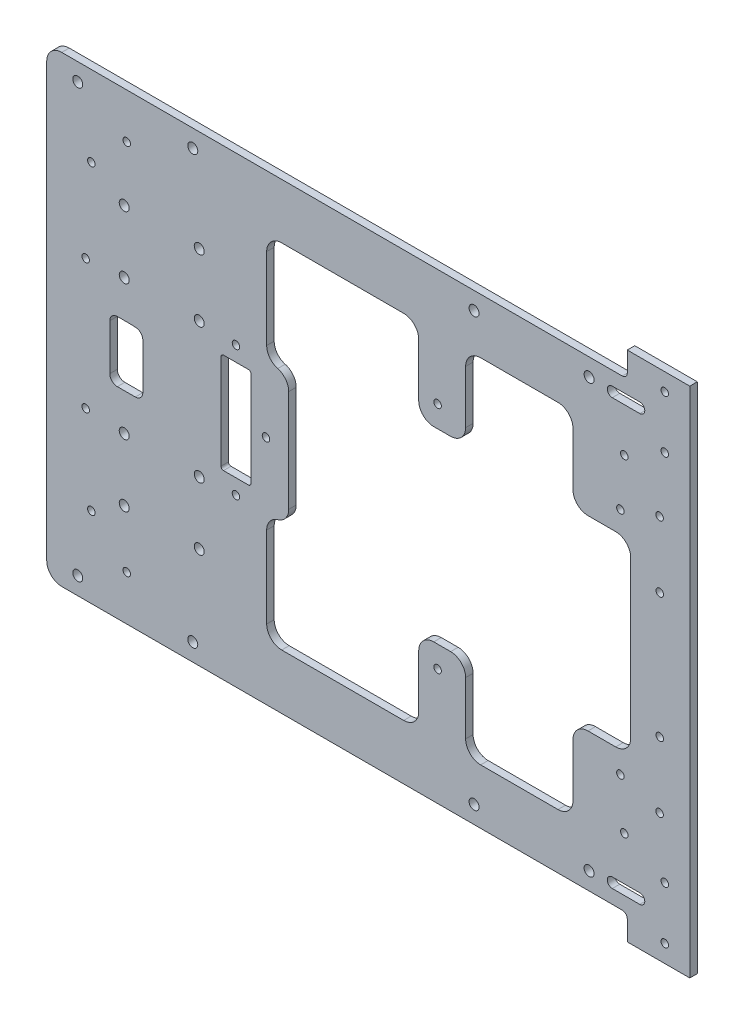
from build123d import *

# Parameters (mm, degrees)
EXTRUDE_1_DEPTH      = 3
FILLET_1_R           = 6
FILLET_2_R           = 6
FILLET_3_R           = 2
FILLET_4_R           = 2
SKETCH_3_R           = 2
CUT_EXTRUDE_1_DEPTH  = 3
SKETCH_4_R           = 1.5
CUT_EXTRUDE_2_DEPTH  = 10
SKETCH_5_R           = 2
CUT_EXTRUDE_3_DEPTH  = 10
CUT_EXTRUDE_5_REACH  = 278.87
SKETCH_9_R           = 1.5
CUT_EXTRUDE_6_REACH  = 278.87
FILLET_6_R           = 6
FILLET_7_R           = 6
FILLET_8_R           = 6
CUT_EXTRUDE_8_REACH  = 278.87
SKETCH_7_R           = 1.5
SKETCH_7_R_2         = 1.499999999
CUT_EXTRUDE_9_REACH  = 278.87
CUT_EXTRUDE_10_REACH = 278.87
SKETCH_13_R          = 1.5


with BuildPart() as part:
    # 草图2 → 凸台-拉伸1 (new body)
    with BuildSketch(Plane.XY):
        Polygon((0, -92.5), (0, 92.5), (232.18, 92.5), (232.18, 102.5), (257.18, 102.5), (257.18, -102.5), (232.18, -102.5), (232.18, -92.5), align=None)
    extrude(amount=EXTRUDE_1_DEPTH)

    # 圆角1
    fillet_1_edges = [part.edges().sort_by_distance(p)[0] for p in [
        (0, -92.5, 1.5),
    ]]
    fillet(fillet_1_edges, radius=FILLET_1_R)

    # 圆角2
    fillet_2_edges = [part.edges().sort_by_distance(p)[0] for p in [
        (0, 92.5, 1.5),
    ]]
    fillet(fillet_2_edges, radius=FILLET_2_R)

    # 圆角3
    fillet_3_edges = [part.edges().sort_by_distance(p)[0] for p in [
        (232.18, -92.5, 1.5),
    ]]
    fillet(fillet_3_edges, radius=FILLET_3_R)

    # 圆角4
    fillet_4_edges = [part.edges().sort_by_distance(p)[0] for p in [
        (232.18, 92.5, 1.5),
    ]]
    fillet(fillet_4_edges, radius=FILLET_4_R)

    # 草图3 → 切除-拉伸1 (cut)
    with BuildSketch(Plane(origin=(0, 0, 0), x_dir=(-1, 0, 0), z_dir=(0, 0, -1))):
        with Locations((-216.91, 85.5)):
            Circle(SKETCH_3_R)
        with Locations((-170.91, 85.5)):
            Circle(SKETCH_3_R)
        with Locations(Location((-170.91, -85.5, 0), (0, 0, 180))):
            Circle(SKETCH_3_R)
        with Locations(Location((-216.91, -85.5, 0), (0, 0, 180))):
            Circle(SKETCH_3_R)
        with Locations((-12.41, 85.5)):
            Circle(SKETCH_3_R)
        with Locations((-58.41, 85.5)):
            Circle(SKETCH_3_R)
        with Locations(Location((-58.41, -85.5, 0), (0, 0, 180))):
            Circle(SKETCH_3_R)
        with Locations(Location((-12.41, -85.5, 0), (0, 0, 180))):
            Circle(SKETCH_3_R)
    extrude(amount=-CUT_EXTRUDE_1_DEPTH, mode=Mode.SUBTRACT)

    # 草图4 → 切除-拉伸2 (cut)
    with BuildSketch(Plane(origin=(0, 0, 0), x_dir=(-1, 0, 0), z_dir=(0, 0, -1))):
        with Locations((-247.18, -74.5)):
            Circle(SKETCH_4_R)
        with Locations((-247.18, -95.5)):
            Circle(SKETCH_4_R)
        with Locations((-247.18, 95.5)):
            Circle(SKETCH_4_R)
        with Locations((-247.18, 74.5)):
            Circle(SKETCH_4_R)
        with Locations((-245.123007941, -51.335941194)):
            Circle(SKETCH_4_R)
        with Locations((-230.980872317, -65.478076818)):
            Circle(SKETCH_4_R)
        with Locations((-230.980872317, 65.478076818)):
            Circle(SKETCH_4_R)
        with Locations((-245.123007941, 51.335941194)):
            Circle(SKETCH_4_R)
        with Locations((-17.857864376, -60.357864376)):
            Circle(SKETCH_4_R)
        with Locations((-32, -74.5)):
            Circle(SKETCH_4_R)
        with Locations((-32, 74.5)):
            Circle(SKETCH_4_R)
        with Locations((-17.857864376, 60.357864376)):
            Circle(SKETCH_4_R)
        with BuildLine():
            Line((-237.18, -83), (-226.18, -83))
            ThreePointArc((-226.18, -83), (-224.18, -85), (-226.18, -87))
            Line((-226.18, -87), (-237.18, -87))
            ThreePointArc((-237.18, -87), (-239.18, -85), (-237.18, -83))
        make_face()
        with BuildLine():
            Line((-237.18, 83), (-226.18, 83))
            ThreePointArc((-226.18, 83), (-224.18, 85), (-226.18, 87))
            Line((-226.18, 87), (-237.18, 87))
            ThreePointArc((-237.18, 87), (-239.18, 85), (-237.18, 83))
        make_face()
    extrude(amount=-CUT_EXTRUDE_2_DEPTH, mode=Mode.SUBTRACT)

    # 草图5 → 切除-拉伸3 (cut)
    with BuildSketch(Plane(origin=(0, 0, 0), x_dir=(-1, 0, 0), z_dir=(0, 0, -1))):
        with Locations((-61, -52)):
            Circle(SKETCH_5_R)
        with Locations((-61, -27)):
            Circle(SKETCH_5_R)
        with Locations((-31, -27)):
            Circle(SKETCH_5_R)
        with Locations((-31, -52)):
            Circle(SKETCH_5_R)
        with Locations((-31, 52)):
            Circle(SKETCH_5_R)
        with Locations((-31, 27)):
            Circle(SKETCH_5_R)
        with Locations((-61, 27)):
            Circle(SKETCH_5_R)
        with Locations((-61, 52)):
            Circle(SKETCH_5_R)
    extrude(amount=-CUT_EXTRUDE_3_DEPTH, mode=Mode.SUBTRACT)

    # 草图9 → 切除-拉伸5 (cut, up to next)
    with BuildSketch(Plane(origin=(0, 0, 0), x_dir=(-1, 0, 0), z_dir=(0, 0, -1)), mode=Mode.PRIVATE) as cut_extrude_5_sk1:
        with Locations((-229.424334412, -45.9)):
            Circle(SKETCH_9_R)
    cut_extrude_5_tool1 = extrude(cut_extrude_5_sk1.sketch, amount=-CUT_EXTRUDE_5_REACH, mode=Mode.PRIVATE) & part.part
    # 草图9 → 切除-拉伸5 (cut, up to next)
    with BuildSketch(Plane(origin=(0, 0, 0), x_dir=(-1, 0, 0), z_dir=(0, 0, -1)), mode=Mode.PRIVATE) as cut_extrude_5_sk2:
        with Locations((-229.424334412, 45.9)):
            Circle(SKETCH_9_R)
    cut_extrude_5_tool2 = extrude(cut_extrude_5_sk2.sketch, amount=-CUT_EXTRUDE_5_REACH, mode=Mode.PRIVATE) & part.part
    # 草图9 → 切除-拉伸5 (cut, up to next)
    with BuildSketch(Plane(origin=(0, 0, 0), x_dir=(-1, 0, 0), z_dir=(0, 0, -1)), mode=Mode.PRIVATE) as cut_extrude_5_sk3:
        with Locations((-156.324334412, -45.9)):
            Circle(SKETCH_9_R)
    cut_extrude_5_tool3 = extrude(cut_extrude_5_sk3.sketch, amount=-CUT_EXTRUDE_5_REACH, mode=Mode.PRIVATE) & part.part
    # 草图9 → 切除-拉伸5 (cut, up to next)
    with BuildSketch(Plane(origin=(0, 0, 0), x_dir=(-1, 0, 0), z_dir=(0, 0, -1)), mode=Mode.PRIVATE) as cut_extrude_5_sk4:
        with Locations((-156.324334412, 45.9)):
            Circle(SKETCH_9_R)
    cut_extrude_5_tool4 = extrude(cut_extrude_5_sk4.sketch, amount=-CUT_EXTRUDE_5_REACH, mode=Mode.PRIVATE) & part.part
    add(cut_extrude_5_tool1.solids().sort_by_distance((229.424334, -45.9, 0))[0], mode=Mode.SUBTRACT)
    add(cut_extrude_5_tool2.solids().sort_by_distance((229.424334, 45.9, 0))[0], mode=Mode.SUBTRACT)
    add(cut_extrude_5_tool3.solids().sort_by_distance((156.324334, -45.9, 0))[0], mode=Mode.SUBTRACT)
    add(cut_extrude_5_tool4.solids().sort_by_distance((156.324334, 45.9, 0))[0], mode=Mode.SUBTRACT)

    # 草图10 → 切除-拉伸6 (cut, up to next)
    with BuildSketch(Plane.XY.offset(3), mode=Mode.PRIVATE) as cut_extrude_6_sk1:
        Polygon((87.968734163, 39.661077844), (87.968734163, 25.962234754), (96.772591143, 25.962234754), (96.772591143, -25.962234754), (87.968734163, -25.962234754), (87.968734163, -39.661077844), (87.968734163, -70.5), (148.772727138, -70.5), (148.772727138, -37.280957875), (167.532241587, -37.280957875), (167.532241587, -70.5), (210.473561647, -70.5), (210.473561647, -37.280957875), (233.553740131, -37.280957875), (233.553740131, 37.280957875), (210.473561647, 37.280957875), (210.473561647, 70.5), (167.532241587, 70.5), (167.532241587, 37.280957875), (148.772727138, 37.280957875), (148.772727138, 70.5), (87.968734163, 70.5), align=None)
    cut_extrude_6_tool1 = extrude(cut_extrude_6_sk1.sketch, amount=-CUT_EXTRUDE_6_REACH, mode=Mode.PRIVATE) & part.part
    add(cut_extrude_6_tool1.solids().sort_by_distance((157.325298, 0, 3))[0], mode=Mode.SUBTRACT)

    # 圆角6
    fillet_6_edges = [part.edges().sort_by_distance(p)[0] for p in [
        (167.532241587, 70.5, 1.5),
        (210.473561647, 70.5, 1.5),
        (210.473561647, 37.280957875, 1.5),
        (233.553740131, 37.280957875, 1.5),
        (233.553740131, -37.280957875, 1.5),
        (210.473561647, -37.280957875, 1.5),
        (210.473561647, -70.5, 1.5),
        (167.532241587, -70.5, 1.5),
    ]]
    fillet(fillet_6_edges, radius=FILLET_6_R)

    # 圆角7
    fillet_7_edges = [part.edges().sort_by_distance(p)[0] for p in [
        (87.968734163, 70.5, 1.5),
        (148.772727138, 70.5, 1.5),
        (148.772727138, 37.280957875, 1.5),
        (167.532241587, 37.280957875, 1.5),
        (167.532241587, -37.280957875, 1.5),
        (148.772727138, -37.280957875, 1.5),
        (148.772727138, -70.5, 1.5),
        (87.968734163, -70.5, 1.5),
        (87.968734163, -25.962234754, 1.5),
        (87.968734163, 25.962234754, 1.5),
    ]]
    fillet(fillet_7_edges, radius=FILLET_7_R)

    # 圆角8
    fillet_8_edges = [part.edges().sort_by_distance(p)[0] for p in [
        (96.772591143, 25.962234754, 1.5),
        (96.772591143, -25.962234754, 1.5),
    ]]
    fillet(fillet_8_edges, radius=FILLET_8_R)

    # 草图7 → 切除-拉伸8 (cut, up to next)
    with BuildSketch(Plane.XY, mode=Mode.PRIVATE) as cut_extrude_8_sk1:
        with Locations(Location((15.593833762, 26, 0), (0, 0, 180))):
            Circle(SKETCH_7_R)
    cut_extrude_8_tool1 = extrude(cut_extrude_8_sk1.sketch, amount=CUT_EXTRUDE_8_REACH, mode=Mode.PRIVATE) & part.part
    # 草图7 → 切除-拉伸8 (cut, up to next)
    with BuildSketch(Plane.XY, mode=Mode.PRIVATE) as cut_extrude_8_sk2:
        with Locations(Location((15.593833762, -26, 0), (0, 0, 180))):
            Circle(SKETCH_7_R)
    cut_extrude_8_tool2 = extrude(cut_extrude_8_sk2.sketch, amount=CUT_EXTRUDE_8_REACH, mode=Mode.PRIVATE) & part.part
    # 草图7 → 切除-拉伸8 (cut, up to next)
    with BuildSketch(Plane.XY, mode=Mode.PRIVATE) as cut_extrude_8_sk3:
        with Locations(Location((75.691018103, -26, 0), (0, 0, 180))):
            Circle(SKETCH_7_R_2)
    cut_extrude_8_tool3 = extrude(cut_extrude_8_sk3.sketch, amount=CUT_EXTRUDE_8_REACH, mode=Mode.PRIVATE) & part.part
    # 草图7 → 切除-拉伸8 (cut, up to next)
    with BuildSketch(Plane.XY, mode=Mode.PRIVATE) as cut_extrude_8_sk4:
        with Locations(Location((75.691018103, 26, 0), (0, 0, 180))):
            Circle(SKETCH_7_R_2)
    cut_extrude_8_tool4 = extrude(cut_extrude_8_sk4.sketch, amount=CUT_EXTRUDE_8_REACH, mode=Mode.PRIVATE) & part.part
    # 草图7 → 切除-拉伸8 (cut, up to next)
    with BuildSketch(Plane.XY, mode=Mode.PRIVATE) as cut_extrude_8_sk5:
        with Locations(Location((87.691018103, 0, 0), (0, 0, 180))):
            Circle(SKETCH_7_R_2)
    cut_extrude_8_tool5 = extrude(cut_extrude_8_sk5.sketch, amount=CUT_EXTRUDE_8_REACH, mode=Mode.PRIVATE) & part.part
    # 草图7 → 切除-拉伸8 (cut, up to next)
    with BuildSketch(Plane.XY, mode=Mode.PRIVATE) as cut_extrude_8_sk6:
        with BuildLine():
            Line((70.691018103, 20), (80.691018103, 20))
            ThreePointArc((80.691018103, 20), (81.398124884, 19.707106781), (81.691018103, 19))
            Line((81.691018103, 19), (81.691018103, -19))
            ThreePointArc((81.691018103, -19), (81.398124884, -19.707106781), (80.691018103, -20))
            Line((80.691018103, -20), (70.691018103, -20))
            ThreePointArc((70.691018103, -20), (69.983911322, -19.707106781), (69.691018103, -19))
            Line((69.691018103, -19), (69.691018103, 19))
            ThreePointArc((69.691018103, 19), (69.983911322, 19.707106781), (70.691018103, 20))
        make_face()
    cut_extrude_8_tool6 = extrude(cut_extrude_8_sk6.sketch, amount=CUT_EXTRUDE_8_REACH, mode=Mode.PRIVATE) & part.part
    add(cut_extrude_8_tool1.solids().sort_by_distance((15.593834, 26, 0))[0], mode=Mode.SUBTRACT)
    add(cut_extrude_8_tool2.solids().sort_by_distance((15.593834, -26, 0))[0], mode=Mode.SUBTRACT)
    add(cut_extrude_8_tool3.solids().sort_by_distance((75.691018, -26, 0))[0], mode=Mode.SUBTRACT)
    add(cut_extrude_8_tool4.solids().sort_by_distance((75.691018, 26, 0))[0], mode=Mode.SUBTRACT)
    add(cut_extrude_8_tool5.solids().sort_by_distance((87.691018, 0, 0))[0], mode=Mode.SUBTRACT)
    add(cut_extrude_8_tool6.solids().sort_by_distance((75.691018, 0, 0))[0], mode=Mode.SUBTRACT)

    # 草图12 → 切除-拉伸9 (cut, up to next)
    with BuildSketch(Plane.XY.offset(3), mode=Mode.PRIVATE) as cut_extrude_9_sk1:
        with BuildLine():
            Line((32.93, -12.15), (35.425799662, -12.15))
            ThreePointArc((35.425799662, -12.15), (37.547120006, -11.271320344), (38.425799662, -9.15))
            Line((38.425799662, -9.15), (38.425799662, 9.052583714))
            ThreePointArc((38.425799662, 9.052583714), (37.587184222, 11.133068462), (35.540188473, 12.050402121))
            Line((35.540188473, 12.050402121), (32.93, 12.15))
            Line((32.93, 12.15), (28.23, 12.15))
            ThreePointArc((28.23, 12.15), (26.108679656, 11.271320344), (25.23, 9.15))
            Line((25.23, 9.15), (25.23, 8.15))
            Line((25.23, 8.15), (25.23, 1.2))
            Line((25.23, 1.2), (25.23, -1.2))
            Line((25.23, -1.2), (25.23, -8.15))
            Line((25.23, -8.15), (25.23, -9.15))
            ThreePointArc((25.23, -9.15), (26.108679656, -11.271320344), (28.23, -12.15))
            Line((28.23, -12.15), (32.93, -12.15))
        make_face()
    cut_extrude_9_tool1 = extrude(cut_extrude_9_sk1.sketch, amount=-CUT_EXTRUDE_9_REACH, mode=Mode.PRIVATE) & part.part
    add(cut_extrude_9_tool1.solids().sort_by_distance((31.822082, -0.015319, 3))[0], mode=Mode.SUBTRACT)

    # 草图13 → 切除-拉伸10 (cut, up to next)
    with BuildSketch(Plane.XY.offset(3), mode=Mode.PRIVATE) as cut_extrude_10_sk1:
        with Locations((245.18, 25)):
            Circle(SKETCH_13_R)
    cut_extrude_10_tool1 = extrude(cut_extrude_10_sk1.sketch, amount=-CUT_EXTRUDE_10_REACH, mode=Mode.PRIVATE) & part.part
    # 草图13 → 切除-拉伸10 (cut, up to next)
    with BuildSketch(Plane.XY.offset(3), mode=Mode.PRIVATE) as cut_extrude_10_sk2:
        with Locations((245.18, -25)):
            Circle(SKETCH_13_R)
    cut_extrude_10_tool2 = extrude(cut_extrude_10_sk2.sketch, amount=-CUT_EXTRUDE_10_REACH, mode=Mode.PRIVATE) & part.part
    add(cut_extrude_10_tool1.solids().sort_by_distance((245.18, 25, 3))[0], mode=Mode.SUBTRACT)
    add(cut_extrude_10_tool2.solids().sort_by_distance((245.18, -25, 3))[0], mode=Mode.SUBTRACT)


solid = part.part
